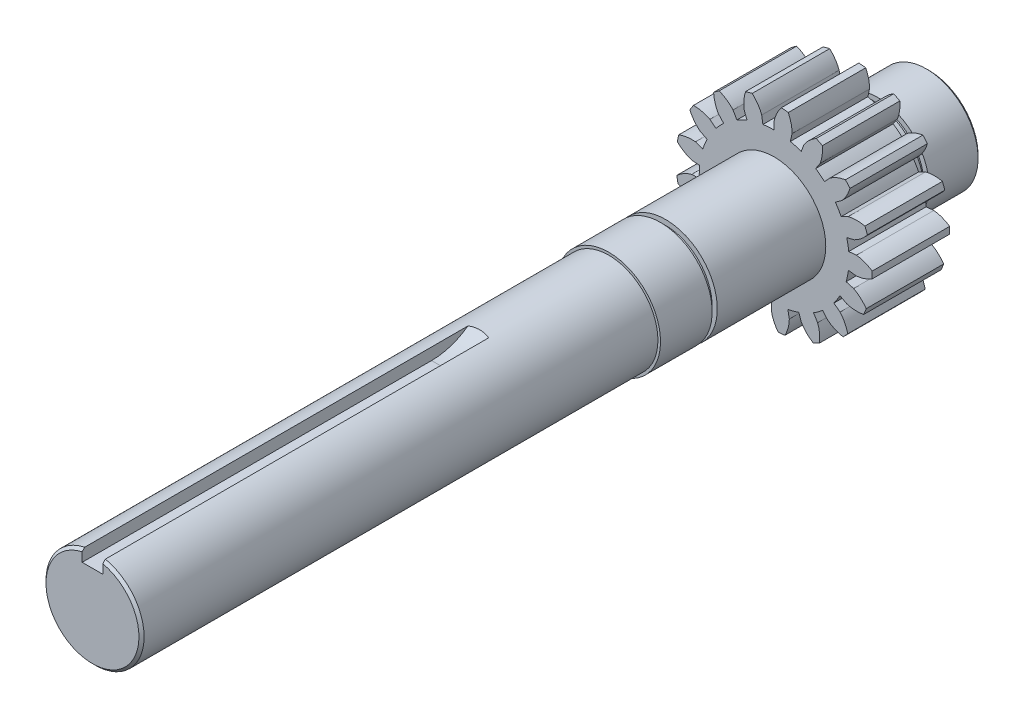
from build123d import *

# Parameters (mm, degrees)
BOSS_EXTRUDE1_DEPTH = 15
CIRPATTERN1_COUNT   = 17
SKETCH2_R           = 10
BOSS_EXTRUDE2_DEPTH = 15
BOSS_EXTRUDE3_START = 32
SKETCH3_R           = 10
BOSS_EXTRUDE3_DEPTH = 32
BOSS_EXTRUDE4_START = 32
SKETCH3_3_R         = 9.5
BOSS_EXTRUDE4_DEPTH = 100
CUT_EXTRUDE1_DEPTH  = 2
SKETCH5_W           = 1
SKETCH5_H           = 1
CHAMFER1_SIZE       = 0.5


with BuildPart() as part:
    # Sketch1 → Boss-Extrude1 (new body)
    with BuildSketch(Plane.XY):
        with BuildLine():
            add(Edge.make_bspline(
                [(0, 16), (0.211333273, 17.090192648), (0.731489963, 18.07159076), (1.410024559, 18.94760752)],
                knots=[0, 0, 0, 0, 0.16668277, 0.16668277, 0.16668277, 0.16668277], degree=3))
            Line((0, 16), (0, 14.5))
            ThreePointArc((0, 14.5), (-1.583138774, -14.413315775), (3.147348837, 14.154299534))
            Line((3.147348837, 14.154299534), (3.472936648, 15.618537417))
            add(Edge.make_bspline(
                [(3.472936648, 15.618537417), (3.503277483, 16.728610025), (3.208542905, 17.799514673), (2.736332451, 18.801927686)],
                knots=[0, 0, 0, 0, 0.16668277, 0.16668277, 0.16668277, 0.16668277], degree=3))
            ThreePointArc((2.736332451, 18.801927686), (2.074457704, 18.886413774), (1.410024559, 18.94760752))
        make_face()
    boss_extrude1 = extrude(amount=BOSS_EXTRUDE1_DEPTH)

    # CirPattern1: Boss-Extrude1 ×17 about axis
    cirpattern1_axis = Axis((0, 0, 0), (0, 0, -1))
    for i in range(1, CIRPATTERN1_COUNT):
        add(boss_extrude1.rotate(cirpattern1_axis, i * 360 / CIRPATTERN1_COUNT))

    # Sketch2 → Boss-Extrude2 (add)
    with BuildSketch(Plane(origin=(0, 0, 0), x_dir=(-1, 0, 0), z_dir=(0, 0, -1))):
        with Locations(Location((0, 0, 0), (0, 0, 180))):
            Circle(SKETCH2_R)
    extrude(amount=BOSS_EXTRUDE2_DEPTH)

    # Sketch3 → Boss-Extrude3 (add)
    with BuildSketch(Plane.XY.offset(15).offset(BOSS_EXTRUDE3_START)):
        Circle(SKETCH3_R)
    extrude(amount=-BOSS_EXTRUDE3_DEPTH)

    # Sketch3<3> → Boss-Extrude4 (add)
    with BuildSketch(Plane.XY.offset(15).offset(BOSS_EXTRUDE4_START)):
        Circle(SKETCH3_3_R)
    extrude(amount=BOSS_EXTRUDE4_DEPTH)

    # Sketch4 → Cut-Extrude1 (cut, symmetric)
    with BuildSketch(Plane(origin=(0, 0, 0), x_dir=(0, 0, -1), z_dir=(1, 0, 0))):
        with BuildLine():
            Line((-147, 9.5), (-147, 7))
            Line((-147, 7), (-79.331439149, 7))
            ThreePointArc((-79.331439149, 7), (-75.458455803, 7.642183308), (-72, 9.5))
            Line((-72, 9.5), (-147, 9.5))
        make_face()
    extrude(amount=CUT_EXTRUDE1_DEPTH, both=True, mode=Mode.SUBTRACT)

    # Sketch5 → Cut-Revolve1 (revolve, cut)
    with BuildSketch(Plane(origin=(0, 0, 0), x_dir=(0, 0, -1), z_dir=(1, 0, 0)), mode=Mode.PRIVATE) as cut_revolve1_sk:
        with Locations((4.5, 9.5)):
            Rectangle(SKETCH5_W, SKETCH5_H)
        with Locations((-36.5, 9.5)):
            Rectangle(SKETCH5_W, SKETCH5_H)
    revolve(cut_revolve1_sk.sketch.rotate(Axis((0, 0, -20.002402944), (0, 0, 1)), 90), axis=Axis((0, 0, -20.002402944), (0, 0, 1)), mode=Mode.SUBTRACT)

    # Chamfer1
    chamfer1_edges = [part.edges().sort_by_distance(p)[0] for p in [
        (-10, 0, -15),
        (-5.968668193, -7.39087275, 147),
    ]]
    chamfer(chamfer1_edges, length=CHAMFER1_SIZE)


solid = part.part
